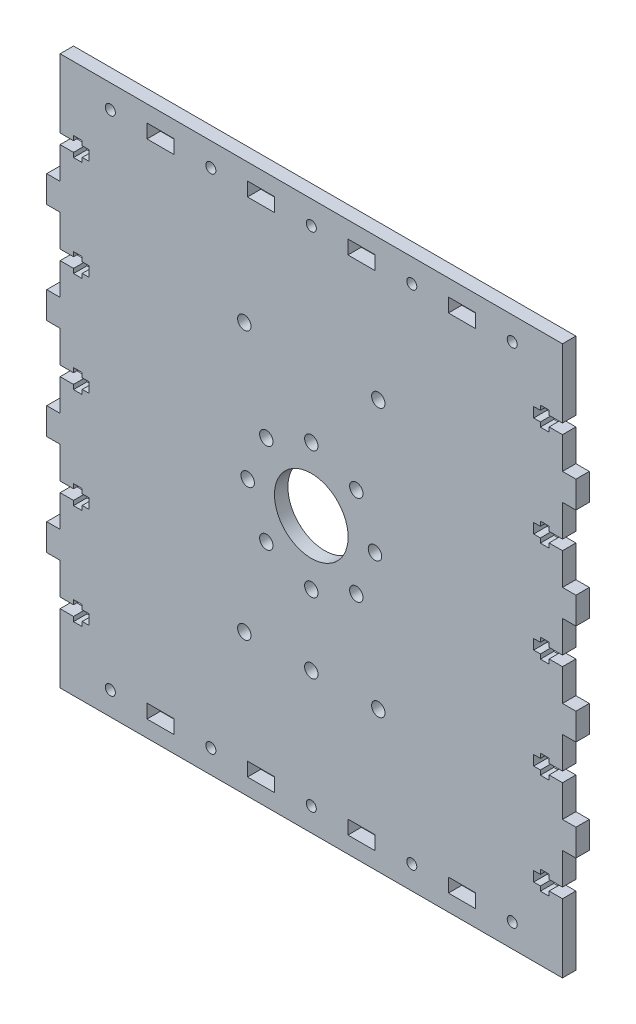
from build123d import *

# Parameters (mm, degrees)
SKETCH_1_R      = 2
SKETCH_1_R_2    = 11
SKETCH_1_R_3    = 1.5
SKETCH_1_W      = 8.12
SKETCH_1_H      = 4.129008776
EXTRUDE_1_DEPTH = 4


with BuildPart() as part:
    # 草图1 → 凸台-拉伸1 (new body)
    with BuildSketch(Plane.XY):
        Polygon((145, 46.5), (149, 46.5), (149, 45.15), (151.6, 45.15), (151.6, 46.5), (153.6, 46.5), (153.6, 49.5), (151.6, 49.5), (151.6, 50.85), (149, 50.85), (149, 49.5), (145, 49.5), (145, 59), (141, 59), (141, 67), (145, 67), (145, 76.5), (149, 76.5), (149, 75.15), (151.6, 75.15), (151.6, 76.5), (153.6, 76.5), (153.6, 79.5), (151.6, 79.5), (151.6, 80.85), (149, 80.85), (149, 79.5), (145, 79.5), (145, 89), (141, 89), (141, 97), (145, 97), (145, 106.5), (149, 106.5), (149, 105.15), (151.6, 105.15), (151.6, 106.5), (153.6, 106.5), (153.6, 109.5), (151.6, 109.5), (151.6, 110.85), (149, 110.85), (149, 109.5), (145, 109.5), (145, 123), (145, 130), (295, 130), (295, 123), (295, 109.5), (291, 109.5), (291, 110.85), (288.4, 110.85), (288.4, 109.5), (286.4, 109.5), (286.4, 106.5), (288.4, 106.5), (288.4, 105.15), (291, 105.15), (291, 106.5), (295, 106.5), (295, 97), (299, 97), (299, 89), (295, 89), (295, 79.5), (291, 79.5), (291, 80.85), (288.4, 80.85), (288.4, 79.5), (286.4, 79.5), (286.4, 76.5), (288.4, 76.5), (288.4, 75.15), (291, 75.15), (291, 76.5), (295, 76.5), (295, 67), (299, 67), (299, 59), (295, 59), (295, 49.5), (291, 49.5), (291, 50.85), (288.4, 50.85), (288.4, 49.5), (286.4, 49.5), (286.4, 46.5), (288.4, 46.5), (288.4, 45.15), (291, 45.15), (291, 46.5), (295, 46.5), (295, 37), (299, 37), (299, 29), (295, 29), (295, 19.5), (291, 19.5), (291, 20.85), (288.4, 20.85), (288.4, 19.5), (286.4, 19.5), (286.4, 16.5), (288.4, 16.5), (288.4, 15.15), (291, 15.15), (291, 16.5), (295, 16.5), (295, 7), (299, 7), (299, -1), (295, -1), (295, -10.5), (291, -10.5), (291, -9.15), (288.4, -9.15), (288.4, -10.5), (286.4, -10.5), (286.4, -13.5), (288.4, -13.5), (288.4, -14.85), (291, -14.85), (291, -13.5), (295, -13.5), (295, -27), (295, -34), (145, -34), (145, -27), (145, -13.5), (149, -13.5), (149, -14.85), (151.6, -14.85), (151.6, -13.5), (153.6, -13.5), (153.6, -10.5), (151.6, -10.5), (151.6, -9.15), (149, -9.15), (149, -10.5), (145, -10.5), (145, -1), (141, -1), (141, 7), (145, 7), (145, 16.5), (149, 16.5), (149, 15.15), (151.6, 15.15), (151.6, 16.5), (153.6, 16.5), (153.6, 19.5), (151.6, 19.5), (151.6, 20.85), (149, 20.85), (149, 19.5), (145, 19.5), (145, 29), (141, 29), (141, 37), (145, 37), align=None)
        with Locations((220, 29)):
            Circle(SKETCH_1_R, mode=Mode.SUBTRACT)
        with Locations((220, 48)):
            Circle(SKETCH_1_R_2, mode=Mode.SUBTRACT)
        with Locations((206.564971157, 34.564971157)):
            Circle(SKETCH_1_R, mode=Mode.SUBTRACT)
        with Locations((201, 48)):
            Circle(SKETCH_1_R, mode=Mode.SUBTRACT)
        with Locations((206.564971157, 61.435028843)):
            Circle(SKETCH_1_R, mode=Mode.SUBTRACT)
        with Locations((220, 67)):
            Circle(SKETCH_1_R, mode=Mode.SUBTRACT)
        with Locations((233.435028843, 61.435028843)):
            Circle(SKETCH_1_R, mode=Mode.SUBTRACT)
        with Locations((239, 48)):
            Circle(SKETCH_1_R, mode=Mode.SUBTRACT)
        with Locations((233.435028843, 34.564971157)):
            Circle(SKETCH_1_R, mode=Mode.SUBTRACT)
        with Locations((220, 123)):
            Circle(SKETCH_1_R_3, mode=Mode.SUBTRACT)
        with Locations((250, 123)):
            Circle(SKETCH_1_R_3, mode=Mode.SUBTRACT)
        with Locations((280, 123)):
            Circle(SKETCH_1_R_3, mode=Mode.SUBTRACT)
        with Locations((160, 123)):
            Circle(SKETCH_1_R_3, mode=Mode.SUBTRACT)
        with Locations((190, 123)):
            Circle(SKETCH_1_R_3, mode=Mode.SUBTRACT)
        with Locations((190, -27)):
            Circle(SKETCH_1_R_3, mode=Mode.SUBTRACT)
        with Locations((160, -27)):
            Circle(SKETCH_1_R_3, mode=Mode.SUBTRACT)
        with Locations((280, -27)):
            Circle(SKETCH_1_R_3, mode=Mode.SUBTRACT)
        with Locations((250, -27)):
            Circle(SKETCH_1_R_3, mode=Mode.SUBTRACT)
        with Locations((220, -27)):
            Circle(SKETCH_1_R_3, mode=Mode.SUBTRACT)
        with Locations((200, 8)):
            Circle(SKETCH_1_R, mode=Mode.SUBTRACT)
        with Locations((240, 8)):
            Circle(SKETCH_1_R, mode=Mode.SUBTRACT)
        with Locations((240, 88)):
            Circle(SKETCH_1_R, mode=Mode.SUBTRACT)
        with Locations((200, 88)):
            Circle(SKETCH_1_R, mode=Mode.SUBTRACT)
        with Locations((220, 8)):
            Circle(SKETCH_1_R, mode=Mode.SUBTRACT)
        with Locations((205, -27)):
            Rectangle(SKETCH_1_W, SKETCH_1_H, mode=Mode.SUBTRACT)
        with Locations((175, -27)):
            Rectangle(SKETCH_1_W, SKETCH_1_H, mode=Mode.SUBTRACT)
        with Locations((265, -27)):
            Rectangle(SKETCH_1_W, SKETCH_1_H, mode=Mode.SUBTRACT)
        with Locations((235, -27)):
            Rectangle(SKETCH_1_W, SKETCH_1_H, mode=Mode.SUBTRACT)
        with Locations((235, 123)):
            Rectangle(SKETCH_1_W, SKETCH_1_H, mode=Mode.SUBTRACT)
        with Locations((265, 123)):
            Rectangle(SKETCH_1_W, SKETCH_1_H, mode=Mode.SUBTRACT)
        with Locations((175, 123)):
            Rectangle(SKETCH_1_W, SKETCH_1_H, mode=Mode.SUBTRACT)
        with Locations((205, 123)):
            Rectangle(SKETCH_1_W, SKETCH_1_H, mode=Mode.SUBTRACT)
    extrude(amount=EXTRUDE_1_DEPTH)


solid = part.part
